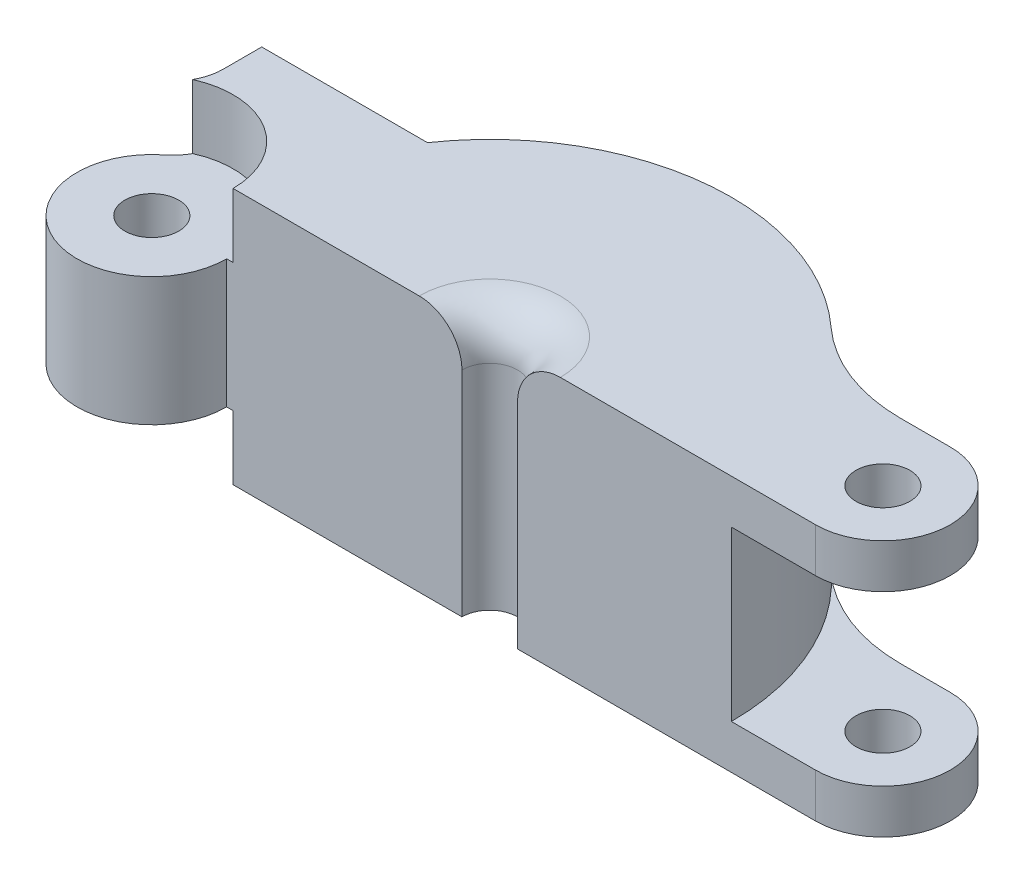
from build123d import *

# Parameters (mm, degrees)
SKETCH1_R               = 1.6000000000000016
SKETCH1_R_2             = 1.6000000000000019
BOSS_EXTRUDE1_DEPTH     = 15.239999999999998
SKETCH2_R               = 4.8260000000000005
CUT_EXTRUDE1_DEPTH      = 3.8099999999999996
FILLET2_R               = 2.54
FILLET3_R               = 3
CUT_EXTRUDE2_DEPTH      = 5
CUT_EXTRUDE2_DEPTH_BACK = 5
FILLET4_R               = 10


with BuildPart() as part:
    # Sketch1 → Boss-Extrude1 (new body)
    with BuildSketch(Plane(origin=(0, 0, 0), x_dir=(1, 0, 0), z_dir=(0, 1, 0))):
        with BuildLine():
            ThreePointArc((11.827375744432914, 8.128), (0, 14.350999999999997), (-11.827375744432915, 8.128))
            Line((-11.827375744432912, 8.128), (-21.67, 8.127999999999998))
            Line((-21.67, 8.127999999999998), (-21.67, 4.147050156436499))
            ThreePointArc((-21.67, 4.1470501564365), (-22.584560100693558, -3.665380266766329), (-15.625, 2.9e-16))
            Line((-15.625, 0), (-1.6509999999999998, 0))
            ThreePointArc((-1.651, -4.2e-16), (-3.8e-16, 1.6509999999999998), (1.6509999999999996, 0))
            Line((1.6509999999999998, 0), (14.350999999999999, -1.6e-16))
            Line((14.350999999999999, -1.6e-16), (19.351, 8.7e-16))
            ThreePointArc((19.351, 1.78e-15), (23.351, 4.000000000000002), (19.351, 8.000000000000002))
            Line((19.351, 8.000000000000002), (11.914327551314004, 8))
            ThreePointArc((11.914327551314003, 7.999999999999999), (11.871024170046155, 8.064117196208148), (11.82737574443291, 8.128))
        make_face()
        with Locations(Location((-20.07, 0, 0), (0, 0, 90))):
            Circle(SKETCH1_R, mode=Mode.SUBTRACT)
        with Locations(Location((19.351, 4.000000000000001, 0), (0, 0, 90))):
            Circle(SKETCH1_R_2, mode=Mode.SUBTRACT)
    extrude(amount=BOSS_EXTRUDE1_DEPTH)

    # Sketch2 → Cut-Extrude1 (cut, symmetric)
    with BuildSketch(Plane(origin=(0, 15.239999999999998, 0), x_dir=(1, 0, 0), z_dir=(0, 1, 0))):
        with Locations((-20.07, 0)):
            Circle(SKETCH2_R)
    cut_extrude1 = extrude(amount=CUT_EXTRUDE1_DEPTH, both=True, mode=Mode.SUBTRACT)

    # Fillet2
    fillet2_edges = [part.edges().sort_by_distance(p)[0] for p in [
        (-3.8e-16, 15.239999999999998, -1.6509999999999998),
    ]]
    fillet(fillet2_edges, radius=FILLET2_R)

    # Mirror1: Cut-Extrude1 across plane
    add(cut_extrude1.mirror(Plane.ZX.offset(7.619999999999999)), mode=Mode.SUBTRACT)

    # Fillet3
    fillet3_edges = [part.edges().sort_by_distance(p)[0] for p in [
        (-21.67, 7.619999999999999, -4.1470501564365),
    ]]
    fillet(fillet3_edges, radius=FILLET3_R)

    # Sketch3 → Cut-Extrude2 (cut, two sides: drawn at the far end of the back side and taken through both)
    with BuildSketch(Plane(origin=(0, 7.619999999999999, 0), x_dir=(1, 0, 0), z_dir=(0, 1, 0)).offset(-CUT_EXTRUDE2_DEPTH_BACK)):
        with BuildLine():
            Line((14.350999999999999, -1.6e-16), (19.351, 8.7e-16))
            ThreePointArc((19.351, 8.7e-16), (23.351, 4.000000000000001), (19.351, 8))
            Line((19.351, 8), (11.914327551314004, 8))
            ThreePointArc((11.914327551314004, 8), (13.728323198572127, 4.181428363077186), (14.350999999999999, -1.6e-16))
        make_face()
    extrude(amount=CUT_EXTRUDE2_DEPTH + CUT_EXTRUDE2_DEPTH_BACK, mode=Mode.SUBTRACT)

    # Fillet4
    fillet4_edges = [part.edges().sort_by_distance(p)[0] for p in [
        (11.914327551314003, 13.93, -8),
        (11.914327551314003, 1.3099999999999996, -8),
    ]]
    fillet(fillet4_edges, radius=FILLET4_R)


solid = part.part
